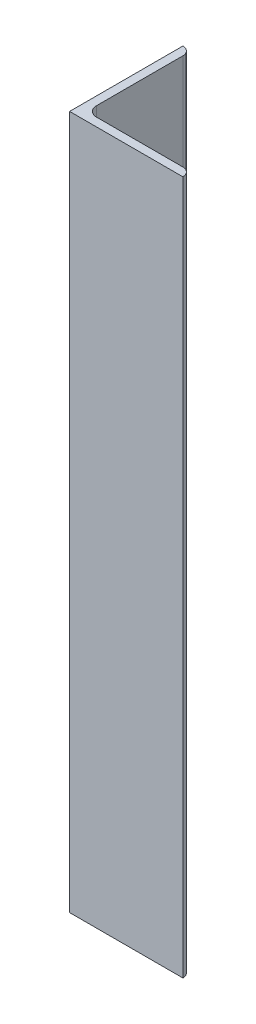
from build123d import *

# Parameters (mm, degrees)
IRON_V40X40X3_1_DEPTH = 245


with BuildPart() as part:
    # Sketch1 → Iron V40X40X3(1) (new body)
    with BuildSketch(Plane(origin=(0, 0, 0), x_dir=(1, 0, 0), z_dir=(0, 1, 0))):
        with BuildLine():
            Line((0, 0), (0, 40))
            ThreePointArc((0, 40), (2.121320344, 39.121320344), (3, 37))
            Line((3, 37), (3, 6.5))
            ThreePointArc((3, 6.5), (4.025126266, 4.025126266), (6.5, 3))
            Line((6.5, 3), (37, 3))
            ThreePointArc((37, 3), (39.121320344, 2.121320344), (40, 0))
            Line((40, 0), (0, 0))
        make_face()
    extrude(amount=IRON_V40X40X3_1_DEPTH)


solid = part.part
